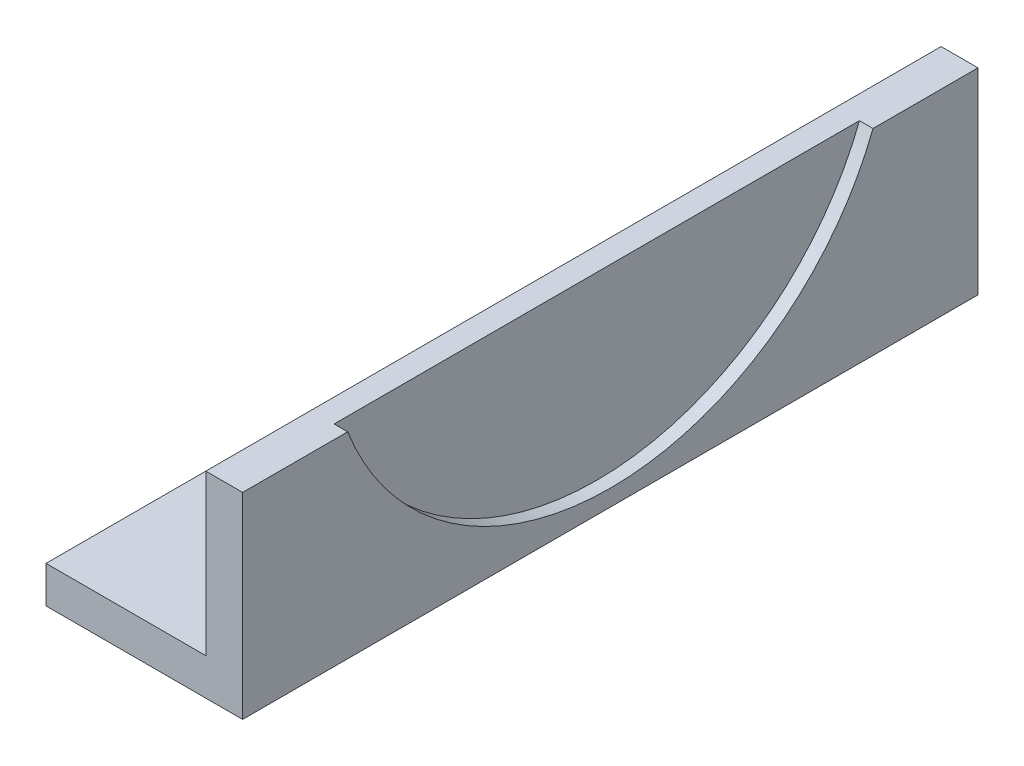
from build123d import *

# Parameters (mm, degrees)
BOSS_EXTRUDE1_DEPTH = 190
SKETCH3_R           = 72.75
CUT_EXTRUDE3_DEPTH  = 3.5


with BuildPart() as part:
    # Sketch1 → Boss-Extrude1 (new body)
    with BuildSketch(Plane.XY):
        Polygon((-25.4, -25.4), (25.4, -25.4), (25.4, 25.4), (15.875, 25.4), (15.875, -15.875), (-25.4, -15.875), align=None)
    extrude(amount=BOSS_EXTRUDE1_DEPTH)

    # Sketch3 → Cut-Extrude3 (cut)
    with BuildSketch(Plane(origin=(25.4, 0, 0), x_dir=(0, 0, -1), z_dir=(1, 0, 0))):
        with Locations((-95, 51.6)):
            Circle(SKETCH3_R)
    extrude(amount=-CUT_EXTRUDE3_DEPTH, mode=Mode.SUBTRACT)


solid = part.part
